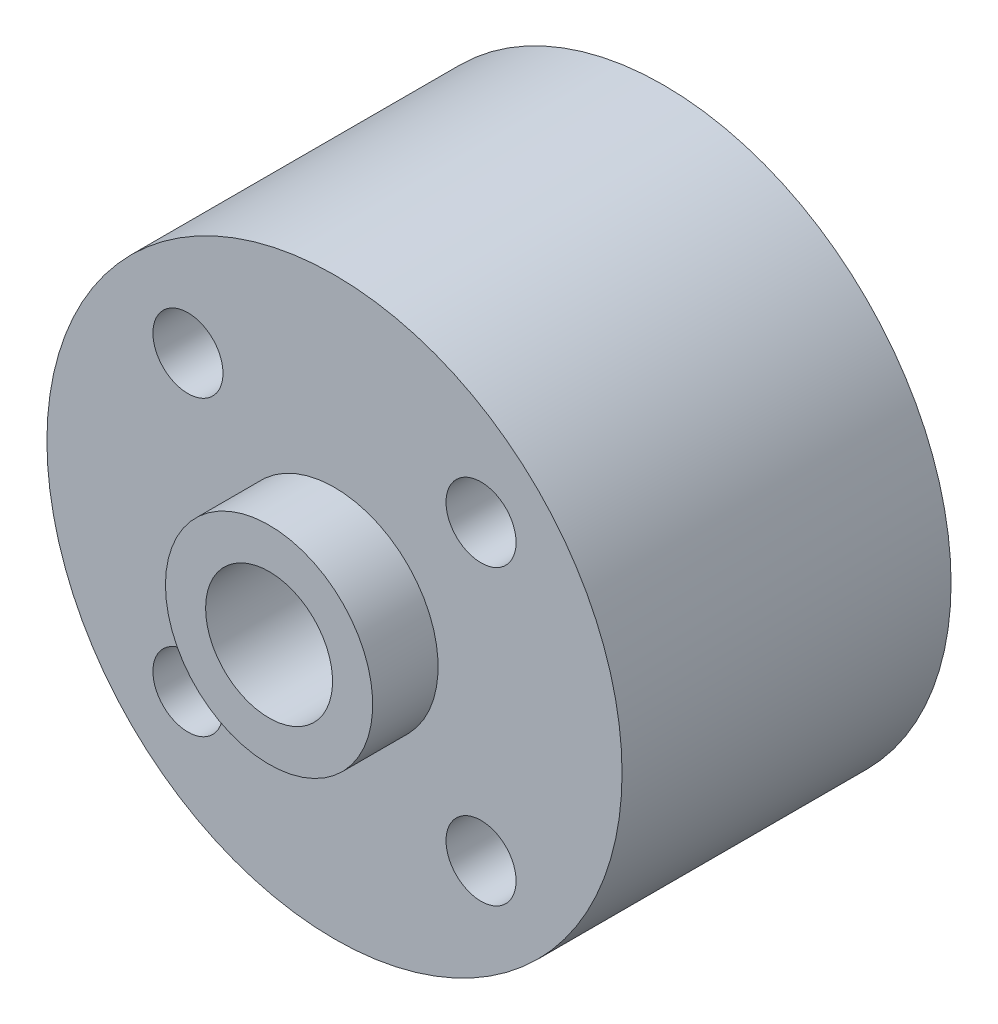
from build123d import *

# Parameters (mm, degrees)
SKETCH1_W                  = 11.1
SKETCH1_H                  = 12.7
SKETCH2_R                  = 4
BOSS_EXTRUDE1_DEPTH        = 2.525
BOSS_EXTRUDE2_START        = 2.525
SKETCH3_R                  = 4
BOSS_EXTRUDE2_DEPTH        = 2.525
M2_5_CLEARANCE_HOLE1_D     = 2.705
M2_5_CLEARANCE_HOLE1_DEPTH = 15.225
F_4_9_4_9_DIAMETER_HOLE1_D = 4.9


with BuildPart() as part:
    # Sketch1 → Revolve1 (revolve)
    with BuildSketch(Plane(origin=(0, 0, 0), x_dir=(1, 0, 0), z_dir=(0, 1, 0))):
        with Locations((5.55, 0)):
            Rectangle(SKETCH1_W, SKETCH1_H)
    revolve(axis=Axis((0, 0, -6.35), (0, 0, 1)))

    # Sketch2 → Boss-Extrude1 (add)
    with BuildSketch(Plane(origin=(0, 0, -6.35), x_dir=(-1, 0, 0), z_dir=(0, 0, -1))):
        with Locations(Location((0, 0, 0), (0, 0, 180))):
            Circle(SKETCH2_R)
    extrude(amount=BOSS_EXTRUDE1_DEPTH)

    # Sketch3 → Boss-Extrude2 (add)
    with BuildSketch(Plane.XY.offset(6.35).offset(BOSS_EXTRUDE2_START)):
        Circle(SKETCH3_R)
    extrude(amount=-BOSS_EXTRUDE2_DEPTH)

    # M2.5 Clearance Hole1
    with Locations(Plane.XY.offset(6.35)):
        with Locations((5.656854249, 5.656854249), (-5.656854249, 5.656854249), (-5.656854249, -5.656854249), (5.656854249, -5.656854249)):
            Hole(M2_5_CLEARANCE_HOLE1_D / 2, depth=M2_5_CLEARANCE_HOLE1_DEPTH)

    # Ø4.9 (4.9) Diameter Hole1 (through all)
    with Locations(Plane(origin=(0, 0, -8.875), x_dir=(-1, 0, 0), z_dir=(0, 0, -1))):
        with Locations((0, 0)):
            Hole(F_4_9_4_9_DIAMETER_HOLE1_D / 2)


solid = part.part
